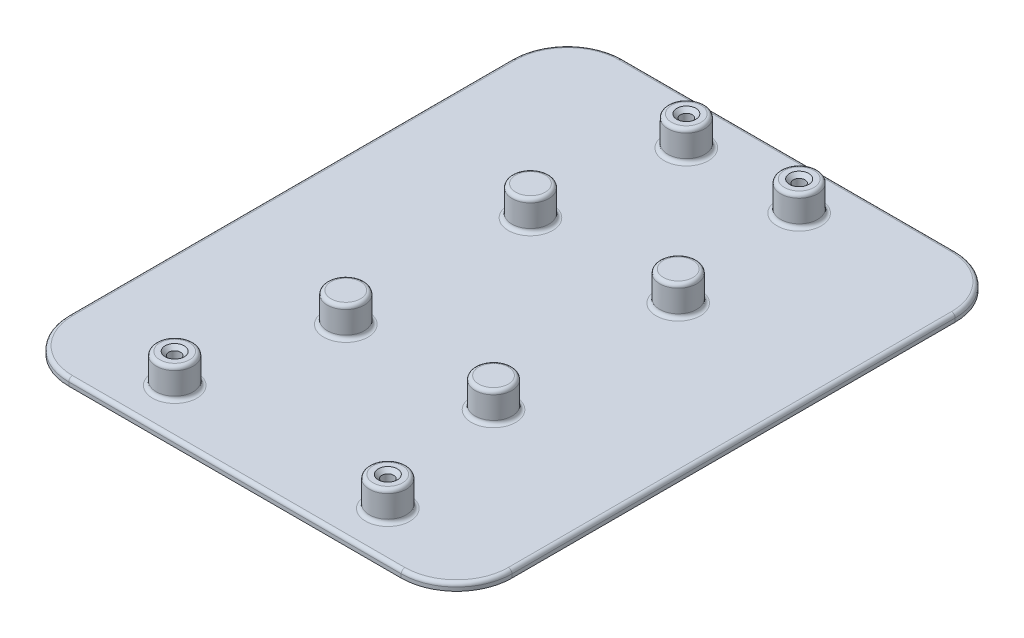
from build123d import *

# Parameters (mm, degrees)
BOSS_EXTRUDE1_DEPTH = 2
SKETCH2_R           = 5
SKETCH2_R_2         = 1.5875
BOSS_EXTRUDE2_DEPTH = 8
FILLET1_R           = 1
CHAMFER1_SIZE       = 1


with BuildPart() as part:
    # Sketch1 → Boss-Extrude1 (new body)
    with BuildSketch(Plane(origin=(0, 0, 0), x_dir=(1, 0, 0), z_dir=(0, 1, 0))):
        with BuildLine():
            Line((15, 0), (105, 0))
            ThreePointArc((105, 0), (115.606601718, 4.393398282), (120, 15))
            Line((120, 15), (120, 135))
            ThreePointArc((120, 135), (115.606601718, 145.606601718), (105, 150))
            Line((105, 150), (15, 150))
            ThreePointArc((15, 150), (4.393398282, 145.606601718), (0, 135))
            Line((0, 135), (0, 15))
            ThreePointArc((0, 15), (4.393398282, 4.393398282), (15, 0))
        make_face()
    extrude(amount=BOSS_EXTRUDE1_DEPTH)

    # Sketch2 → Boss-Extrude2 (add)
    # profile 1 of 8: a face of its own
    with BuildSketch(Plane(origin=(0, 2, 0), x_dir=(1, 0, 0), z_dir=(0, 1, 0))):
        with Locations(Location((44.725, 137.475, 0), (0, 0, 90))):
            Circle(SKETCH2_R)
        with Locations(Location((44.725, 137.475, 0), (0, 0, 270))):
            Circle(SKETCH2_R_2, mode=Mode.SUBTRACT)
    # profile 2 of 8: a face of its own
    with BuildSketch(Plane(origin=(0, 2, 0), x_dir=(1, 0, 0), z_dir=(0, 1, 0))):
        with Locations(Location((75.275, 137.475, 0), (0, 0, 90))):
            Circle(SKETCH2_R)
        with Locations(Location((75.275, 137.475, 0), (0, 0, 270))):
            Circle(SKETCH2_R_2, mode=Mode.SUBTRACT)
    # profile 3 of 8: a face of its own
    with BuildSketch(Plane(origin=(0, 2, 0), x_dir=(1, 0, 0), z_dir=(0, 1, 0))):
        with Locations(Location((31.15, 12.525, 0), (0, 0, 90))):
            Circle(SKETCH2_R)
        with Locations(Location((31.15, 12.525, 0), (0, 0, 270))):
            Circle(SKETCH2_R_2, mode=Mode.SUBTRACT)
    # profile 4 of 8: a face of its own
    with BuildSketch(Plane(origin=(0, 2, 0), x_dir=(1, 0, 0), z_dir=(0, 1, 0))):
        with Locations(Location((88.85, 12.525, 0), (0, 0, 90))):
            Circle(SKETCH2_R)
        with Locations(Location((88.85, 12.525, 0), (0, 0, 270))):
            Circle(SKETCH2_R_2, mode=Mode.SUBTRACT)
    # profile 5 of 8: a face of its own
    with BuildSketch(Plane(origin=(0, 2, 0), x_dir=(1, 0, 0), z_dir=(0, 1, 0))):
        with Locations(Location((40, 50, 0), (0, 0, 90))):
            Circle(SKETCH2_R)
    # profile 6 of 8: a face of its own
    with BuildSketch(Plane(origin=(0, 2, 0), x_dir=(1, 0, 0), z_dir=(0, 1, 0))):
        with Locations(Location((80, 50, 0), (0, 0, 90))):
            Circle(SKETCH2_R)
    # profile 7 of 8: a face of its own
    with BuildSketch(Plane(origin=(0, 2, 0), x_dir=(1, 0, 0), z_dir=(0, 1, 0))):
        with Locations(Location((40, 100, 0), (0, 0, 90))):
            Circle(SKETCH2_R)
    # profile 8 of 8: a face of its own
    with BuildSketch(Plane(origin=(0, 2, 0), x_dir=(1, 0, 0), z_dir=(0, 1, 0))):
        with Locations(Location((80, 100, 0), (0, 0, 90))):
            Circle(SKETCH2_R)
    extrude(amount=BOSS_EXTRUDE2_DEPTH)

    # Fillet1
    fillet1_edges = [part.edges().sort_by_distance(p)[0] for p in [
        (115.606601718, 2, -4.393398282),
        (120, 2, -75),
        (115.606601718, 2, -145.606601718),
        (60, 2, -150),
        (75.275, 2, -132.475),
        (75.275, 10, -132.475),
        (4.393398282, 2, -145.606601718),
        (31.15, 2, -7.525),
        (31.15, 10, -7.525),
        (0, 2, -75),
        (44.725, 2, -132.475),
        (44.725, 10, -132.475),
        (88.85, 2, -7.525),
        (88.85, 10, -7.525),
        (40, 2, -45),
        (4.393398282, 2, -4.393398282),
        (40, 10, -45),
        (80, 2, -45),
        (80, 10, -45),
        (40, 2, -95),
        (40, 10, -95),
        (80, 2, -95),
        (80, 10, -95),
        (60, 2, 0),
    ]]
    fillet(fillet1_edges, radius=FILLET1_R)

    # Chamfer1
    chamfer1_edges = [part.edges().sort_by_distance(p)[0] for p in [
        (75.275, 10, -139.0625),
        (31.15, 10, -14.1125),
        (44.725, 10, -139.0625),
        (88.85, 10, -14.1125),
    ]]
    chamfer(chamfer1_edges, length=CHAMFER1_SIZE)


solid = part.part
